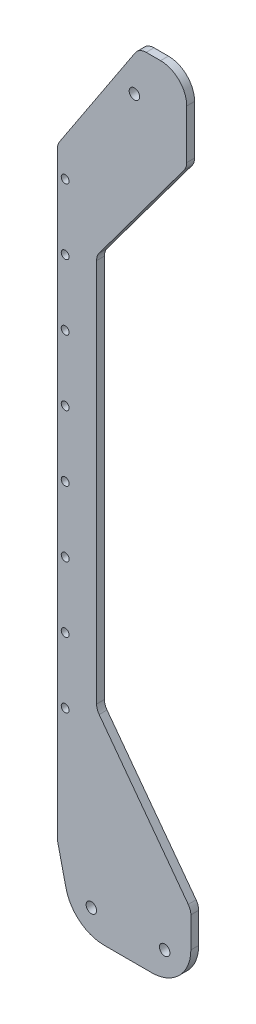
from build123d import *

# Parameters (mm, degrees)
SKETCH_1_R          = 2
EXTRUDE_1_DEPTH     = 3
SKETCH_2_R          = 1.5
CUT_EXTRUDE_1_DEPTH = 306.548310575
FILLET_1_R          = 15
FILLET_2_R          = 5
FILLET_3_R          = 10


with BuildPart() as part:
    # 草图1 → 凸台-拉伸1 (new body)
    with BuildSketch(Plane.XY):
        Polygon((0, 0), (36, 0), (36, 28.269869579), (0, 76.702645079), (0, 226.702645079), (34.436828012, 273.032399523), (34.436828012, 303.405290157), (16.23224311, 303.405290157), (-15, 256), (-15, 26), (-9, 0), align=None)
        with Locations((26, 10)):
            Circle(SKETCH_1_R, mode=Mode.SUBTRACT)
        with Locations(Location((14.436828012, 287.405290157, 0), (0, 0, 180))):
            Circle(SKETCH_1_R, mode=Mode.SUBTRACT)
        with Locations((-2, 10)):
            Circle(SKETCH_1_R, mode=Mode.SUBTRACT)
    extrude(amount=EXTRUDE_1_DEPTH)

    # 草图2 → 切除-拉伸1 (cut, through all)
    with BuildSketch(Plane.XY.offset(3)):
        with Locations((-12, 246)):
            Circle(SKETCH_2_R)
        with Locations((-12, 221)):
            Circle(SKETCH_2_R)
        with Locations((-12, 196)):
            Circle(SKETCH_2_R)
        with Locations((-12, 171)):
            Circle(SKETCH_2_R)
        with Locations((-12, 146)):
            Circle(SKETCH_2_R)
        with Locations((-12, 121)):
            Circle(SKETCH_2_R)
        with Locations((-12, 96)):
            Circle(SKETCH_2_R)
        with Locations((-12, 71)):
            Circle(SKETCH_2_R)
    extrude(amount=-CUT_EXTRUDE_1_DEPTH, mode=Mode.SUBTRACT)

    # 圆角1
    fillet_1_edges = [part.edges().sort_by_distance(p)[0] for p in [
        (-9, 0, 1.5),
        (36, 0, 1.5),
    ]]
    fillet(fillet_1_edges, radius=FILLET_1_R)

    # 圆角2
    fillet_2_edges = [part.edges().sort_by_distance(p)[0] for p in [
        (-15, 26, 1.5),
        (-15, 256, 1.5),
        (16.23224311, 303.405290157, 1.5),
        (34.436828012, 273.032399523, 1.5),
        (0, 226.702645079, 1.5),
        (0, 76.702645079, 1.5),
        (36, 28.269869579, 1.5),
    ]]
    fillet(fillet_2_edges, radius=FILLET_2_R)

    # 圆角3
    fillet_3_edges = [part.edges().sort_by_distance(p)[0] for p in [
        (34.436828012, 303.405290157, 1.5),
    ]]
    fillet(fillet_3_edges, radius=FILLET_3_R)


solid = part.part
